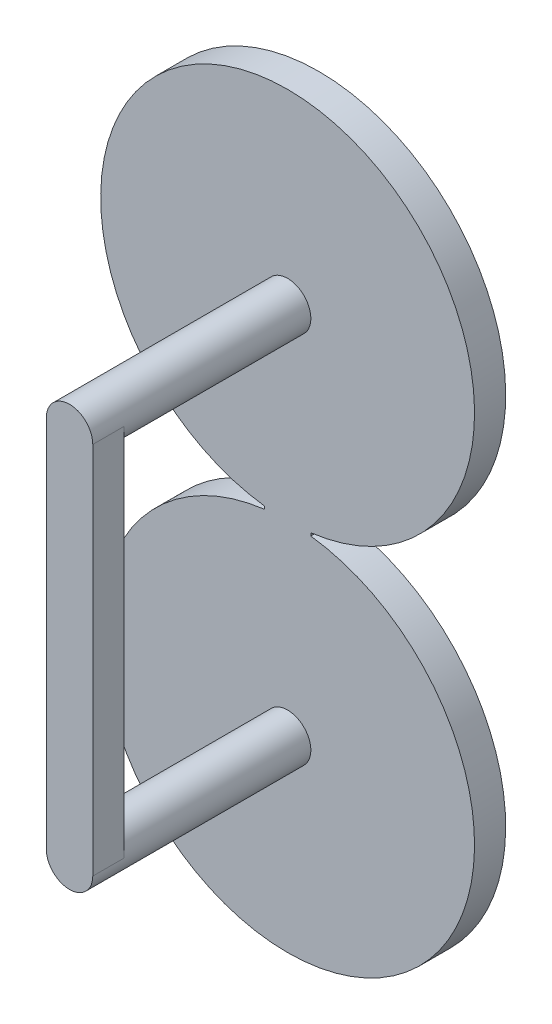
from build123d import *

# Parameters (mm, degrees)
SKETCH_1_R                       = 1.49
EXTRUDE_1_DEPTH                  = 4
EXTRUDE_START                    = 4
SKETCH_2_R                       = 1.49
EXTRUDE_2_DEPTH                  = 4
SKETCH_3_R                       = 1.49
EXTRUDE_3_DEPTH                  = 4
SKETCH_4_W                       = 2.98
SKETCH_4_H                       = 2
EXTRUDE_4_DEPTH                  = 12
EXTRUDE_4_DIRECTION_2_REACH      = 10.273
EXTRUDE_4_DIRECTION_2_END_RADIUS = 1.49
SKETCH_9_R                       = 12
EXTRUDE_6_DEPTH                  = 2
SKETCH_6_W                       = 2.98
SKETCH_6_H                       = 2
EXTRUDE_5_DEPTH                  = 12
EXTRUDE_5_DIRECTION_2_REACH      = 20.762
EXTRUDE_5_DIRECTION_2_END_RADIUS = 1.49


with BuildPart() as part:
    # 草图1 → 凸台-拉伸1 (new body)
    with BuildSketch(Plane.XY):
        Circle(SKETCH_1_R)
    extrude(amount=EXTRUDE_1_DEPTH)

    # 草图2 → 凸台-拉伸2 (add)
    with BuildSketch(Plane(origin=(0, 0, 0), x_dir=(-1, 0, 0), z_dir=(0, 0, -1)).offset(EXTRUDE_START)):
        Circle(SKETCH_2_R)
    extrude(amount=-EXTRUDE_2_DEPTH)

    # 草图3 → 凸台-拉伸3 (add)
    with BuildSketch(Plane.XY.offset(4)):
        with Locations(Location((0, 0, 0), (0, 0, 180))):
            Circle(SKETCH_3_R)
    extrude(amount=EXTRUDE_3_DEPTH)

    # 草图4 → 凸台-拉伸4 (add)
    with BuildSketch(Plane(origin=(0, 0, 0), x_dir=(1, 0, 0), z_dir=(0, 1, 0))):
        with Locations((0, 5)):
            Rectangle(SKETCH_4_W, SKETCH_4_H)
    extrude(amount=EXTRUDE_4_DEPTH)

    # 凸台-拉伸4 direction 2: up to this cylinder (the profile starts inside it)
    extrude_4_direction_2_end = Plane(origin=(0, 0, -5), z_dir=(0, 0, -1)) * Cylinder(EXTRUDE_4_DIRECTION_2_END_RADIUS, 24.526, mode=Mode.PRIVATE)
    # 草图4 → 凸台-拉伸4 direction 2 (add, up to the surface)
    with BuildSketch(Plane(origin=(0, 0, 0), x_dir=(1, 0, 0), z_dir=(0, 1, 0)), mode=Mode.PRIVATE) as extrude_4_direction_2_sk1:
        with Locations((0, 5)):
            Rectangle(SKETCH_4_W, SKETCH_4_H)
    extrude_4_direction_2_tool1 = extrude(extrude_4_direction_2_sk1.sketch, amount=-EXTRUDE_4_DIRECTION_2_REACH, mode=Mode.PRIVATE) & extrude_4_direction_2_end
    add(extrude_4_direction_2_tool1.solids().sort_by_distance((0, 0, -5))[0])

    # 草图9 → 凸台-拉伸6 (add)
    with BuildSketch(Plane(origin=(0, 0, -6), x_dir=(-1, 0, 0), z_dir=(0, 0, -1))):
        Circle(SKETCH_9_R)
    extrude(amount=-EXTRUDE_6_DEPTH)

    # 草图6 → 凸台-拉伸5 (add)
    with BuildSketch(Plane(origin=(0, 0, 0), x_dir=(1, 0, 0), z_dir=(0, 1, 0))):
        with Locations((0, -9)):
            Rectangle(SKETCH_6_W, SKETCH_6_H)
    extrude(amount=EXTRUDE_5_DEPTH)

    # 凸台-拉伸5 direction 2: up to this cylinder (the profile starts inside it)
    extrude_5_direction_2_end = Plane(origin=(0, 0, 9), z_dir=(0, 0, -1)) * Cylinder(EXTRUDE_5_DIRECTION_2_END_RADIUS, 45.504, mode=Mode.PRIVATE)
    # 草图6 → 凸台-拉伸5 direction 2 (add, up to the surface)
    with BuildSketch(Plane(origin=(0, 0, 0), x_dir=(1, 0, 0), z_dir=(0, 1, 0)), mode=Mode.PRIVATE) as extrude_5_direction_2_sk1:
        with Locations((0, -9)):
            Rectangle(SKETCH_6_W, SKETCH_6_H)
    extrude_5_direction_2_tool1 = extrude(extrude_5_direction_2_sk1.sketch, amount=-EXTRUDE_5_DIRECTION_2_REACH, mode=Mode.PRIVATE) & extrude_5_direction_2_end
    add(extrude_5_direction_2_tool1.solids().sort_by_distance((0, 0, 9))[0])

    # 镜向2: part across plane


with BuildPart() as part_1:
    add(part.part)
    add(part.part.mirror(Plane.ZX.offset(12)))


solid = part_1.part
